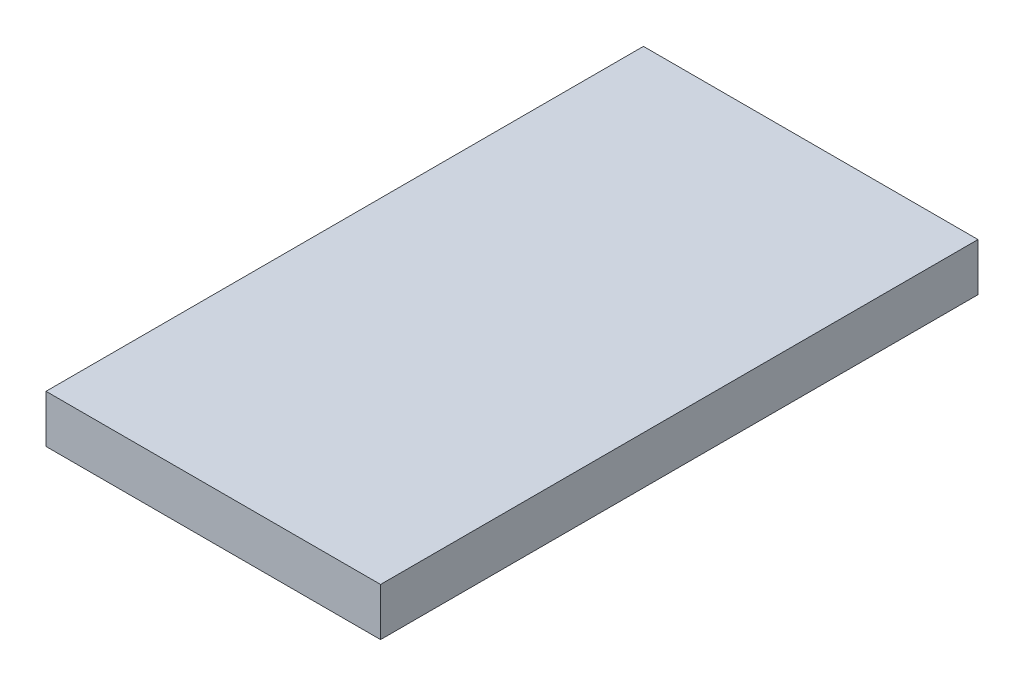
from build123d import *

# Parameters (mm, degrees)
SKETCH1_W           = 44.45
SKETCH1_H           = 79.375
BOSS_EXTRUDE1_DEPTH = 6.35


with BuildPart() as part:
    # Sketch1 → Boss-Extrude1 (new body)
    with BuildSketch(Plane(origin=(0, 0, 0), x_dir=(1, 0, 0), z_dir=(0, 1, 0))):
        with Locations((22.225, 39.6875)):
            Rectangle(SKETCH1_W, SKETCH1_H)
    extrude(amount=BOSS_EXTRUDE1_DEPTH)


solid = part.part
